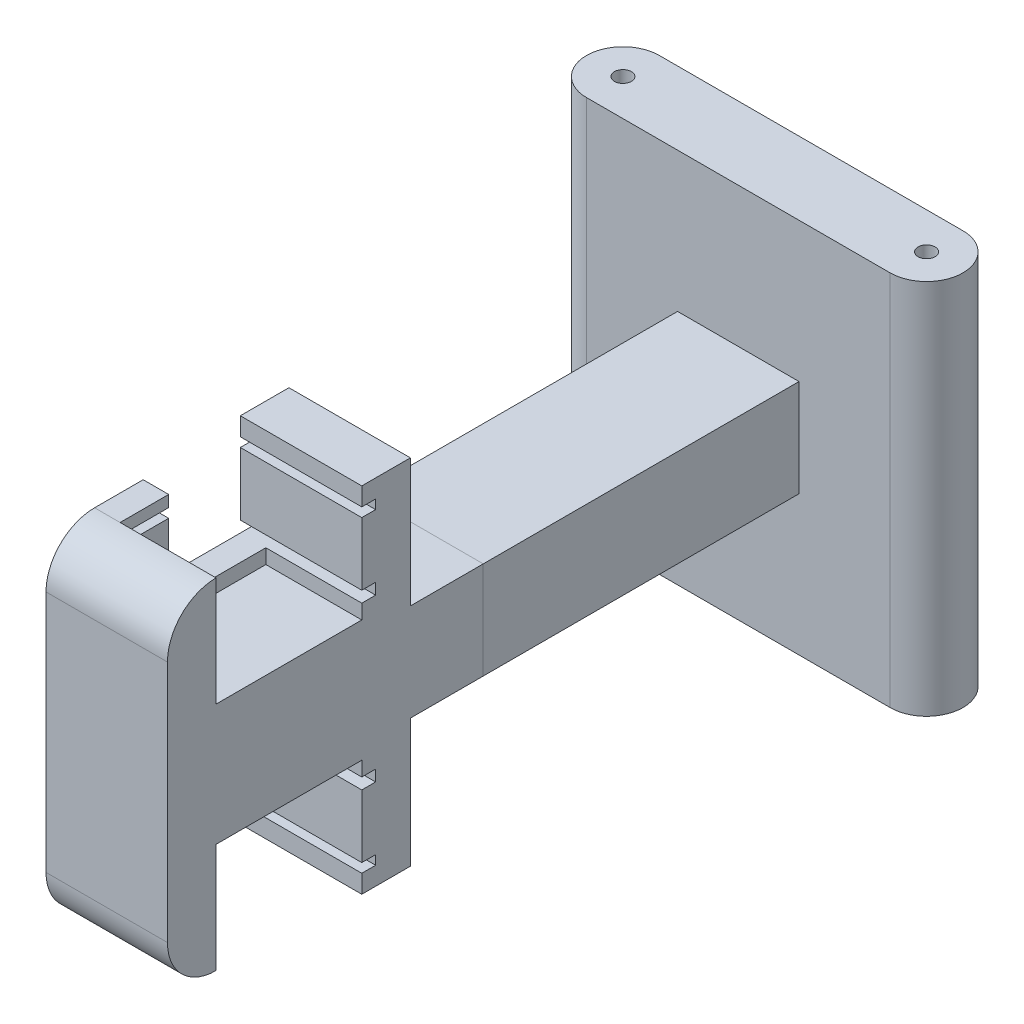
from build123d import *

# Parameters (mm, degrees)
SKETCH1_R                       = 3.5
BOSS_EXTRUDE1_DEPTH             = 77.5
SKETCH2_W                       = 50
SKETCH2_H                       = 40
BOSS_EXTRUDE2_DEPTH             = 260
BOSS_EXTRUDE4_REACH             = 298.036
BOSS_EXTRUDE4_DIRECTION_2_REACH = 298.036
SKETCH6_W                       = 20
SKETCH6_H                       = 45
BOSS_EXTRUDE5_DEPTH             = 4.9
SKETCH9_W                       = 20
SKETCH9_H                       = 4.7
SKETCH9_W_2                     = 60
SKETCH9_H_2                     = 6
SKETCH9_H_3                     = 25.9
BOSS_EXTRUDE7_DEPTH             = 5.6
SKETCH11_W                      = 40
SKETCH11_H                      = 6
BOSS_EXTRUDE8_DEPTH             = 4.9


with BuildPart() as part:
    # Sketch1 → Boss-Extrude1 (new, symmetric)
    with BuildSketch(Plane(origin=(0, 0, 0), x_dir=(1, 0, 0), z_dir=(0, 1, 0))):
        with BuildLine():
            Line((-62.5, 15), (62.5, 15))
            ThreePointArc((62.5, 15), (77.5, 0), (62.5, -15))
            Line((62.5, -15), (-62.5, -15))
            ThreePointArc((-62.5, -15), (-77.5, 0), (-62.5, 15))
        make_face()
        with Locations(Location((-62.5, 0, 0), (0, 0, 270))):
            Circle(SKETCH1_R, mode=Mode.SUBTRACT)
        with Locations(Location((62.5, 0, 0), (0, 0, 270))):
            Circle(SKETCH1_R, mode=Mode.SUBTRACT)
    extrude(amount=BOSS_EXTRUDE1_DEPTH, both=True)

    # Sketch2 → Boss-Extrude2 (add)
    with BuildSketch(Plane.XY.offset(15)):
        Rectangle(SKETCH2_W, SKETCH2_H)
    extrude(amount=BOSS_EXTRUDE2_DEPTH)

    # Boss-Extrude4: up to this face of the body (flat: up to its plane)
    boss_extrude4_end = Plane(part.part.faces().sort_by_distance((25, 0, 145))[0])
    # Sketch5 → Boss-Extrude4 (add, up to the picked face)
    with BuildSketch(Plane(origin=(0, 0, 0), x_dir=(0, 0, -1), z_dir=(1, 0, 0)), mode=Mode.PRIVATE) as boss_extrude4_sk1:
        with BuildLine():
            Line((-275, -20), (-175, -20))
            Line((-175, -20), (-175, -72.8))
            Line((-175, -72.8), (-195, -72.8))
            Line((-195, -72.8), (-195, -65.3))
            Line((-195, -65.3), (-189.3, -65.3))
            Line((-189.3, -65.3), (-189.3, -61.5))
            Line((-189.3, -61.5), (-195, -61.5))
            Line((-195, -61.5), (-195, -35.6))
            Line((-195, -35.6), (-189.3, -35.6))
            Line((-189.3, -35.6), (-189.3, -31))
            Line((-189.3, -31), (-195, -31))
            Line((-195, -31), (-195, -25))
            Line((-195, -25), (-255, -25))
            Line((-255, -25), (-255, -70))
            ThreePointArc((-255, -70), (-269.142135624, -64.142135624), (-275, -50))
            Line((-275, -50), (-275, -20))
        make_face()
    boss_extrude4_tool1 = split(extrude(boss_extrude4_sk1.sketch, amount=BOSS_EXTRUDE4_REACH, mode=Mode.PRIVATE), bisect_by=boss_extrude4_end, keep=Keep.BOTH, mode=Mode.PRIVATE)
    boss_extrude4 = boss_extrude4_tool1.solids().sort_by(Axis((0, -21.130833, 225), (1, 0, 0)))[0]
    add(boss_extrude4)

    # Boss-Extrude4 direction 2: up to this face of the body (flat: up to its plane)
    boss_extrude4_direction_2_end = Plane(part.part.faces().sort_by_distance((-25, 0, 145))[0])
    # Sketch5 → Boss-Extrude4 direction 2 (add, up to the picked face)
    with BuildSketch(Plane(origin=(0, 0, 0), x_dir=(0, 0, -1), z_dir=(1, 0, 0)), mode=Mode.PRIVATE) as boss_extrude4_direction_2_sk1:
        with BuildLine():
            Line((-275, -20), (-175, -20))
            Line((-175, -20), (-175, -72.8))
            Line((-175, -72.8), (-195, -72.8))
            Line((-195, -72.8), (-195, -65.3))
            Line((-195, -65.3), (-189.3, -65.3))
            Line((-189.3, -65.3), (-189.3, -61.5))
            Line((-189.3, -61.5), (-195, -61.5))
            Line((-195, -61.5), (-195, -35.6))
            Line((-195, -35.6), (-189.3, -35.6))
            Line((-189.3, -35.6), (-189.3, -31))
            Line((-189.3, -31), (-195, -31))
            Line((-195, -31), (-195, -25))
            Line((-195, -25), (-255, -25))
            Line((-255, -25), (-255, -70))
            ThreePointArc((-255, -70), (-269.142135624, -64.142135624), (-275, -50))
            Line((-275, -50), (-275, -20))
        make_face()
    boss_extrude4_direction_2_tool1 = split(extrude(boss_extrude4_direction_2_sk1.sketch, amount=-BOSS_EXTRUDE4_DIRECTION_2_REACH, mode=Mode.PRIVATE), bisect_by=boss_extrude4_direction_2_end, keep=Keep.BOTH, mode=Mode.PRIVATE)
    boss_extrude4_direction_2 = boss_extrude4_direction_2_tool1.solids().sort_by(Axis((0, -21.130833, 225), (-1, 0, 0)))[0]
    add(boss_extrude4_direction_2)

    # Sketch6 → Boss-Extrude5 (add)
    with BuildSketch(Plane.ZY.offset(25)):
        with Locations((245, -47.5)):
            Rectangle(SKETCH6_W, SKETCH6_H)
    boss_extrude5 = extrude(amount=-BOSS_EXTRUDE5_DEPTH)

    # Mirror1: Boss-Extrude4, Boss-Extrude4 direction 2, Boss-Extrude5 across plane
    add(boss_extrude4.mirror(Plane.ZX))
    add(boss_extrude4_direction_2.mirror(Plane.ZX))
    add(boss_extrude5.mirror(Plane.ZX))

    # Sketch9 → Boss-Extrude7 (add)
    with BuildSketch(Plane(origin=(-20.1, 0, 0), x_dir=(0, 0, -1), z_dir=(1, 0, 0))):
        with Locations((-245, -67.65)):
            Rectangle(SKETCH9_W, SKETCH9_H)
        with Locations((-225, -28)):
            Rectangle(SKETCH9_W_2, SKETCH9_H_2)
        with Locations((-245, -48.55)):
            Rectangle(SKETCH9_W, SKETCH9_H_3)
    boss_extrude7 = extrude(amount=BOSS_EXTRUDE7_DEPTH)

    # Sketch11 → Boss-Extrude8 (add)
    with BuildSketch(Plane.ZY.offset(20.1)):
        with Locations((215, -28)):
            Rectangle(SKETCH11_W, SKETCH11_H)
    boss_extrude8 = extrude(amount=BOSS_EXTRUDE8_DEPTH)

    # Mirror2: Boss-Extrude7, Boss-Extrude8 across plane
    add(boss_extrude7.mirror(Plane.ZX))
    add(boss_extrude8.mirror(Plane.ZX))


with BuildPart() as body_2:
    # Split1: the piece on the far side of the plane
    add(part.part)
    split(bisect_by=Plane(origin=(0, 0, 145), x_dir=(-1, 0, 0), z_dir=(0, 0, -1)), keep=Keep.BOTTOM)


with BuildPart() as part_1:
    add(part.part)

    # Split1
    split(bisect_by=Plane(origin=(0, 0, 145), x_dir=(-1, 0, 0), z_dir=(0, 0, -1)), keep=Keep.TOP)


solid = Compound([body_2.part, part_1.part])
